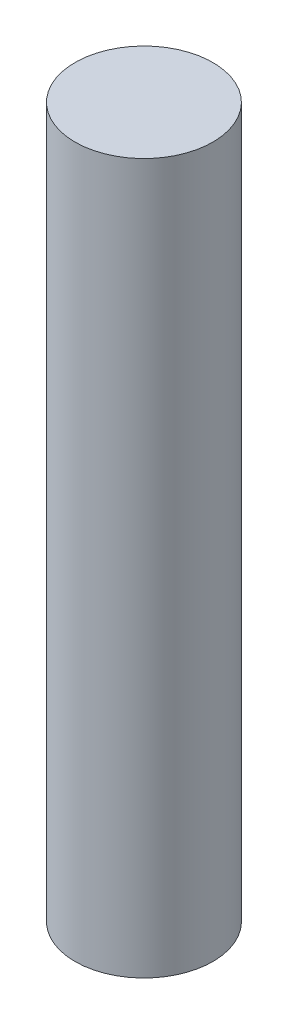
from build123d import *

# Parameters (mm, degrees)
SKETCH1_R           = 4.318
BOSS_EXTRUDE1_DEPTH = 44.45


with BuildPart() as part:
    # Sketch1 → Boss-Extrude1 (new body)
    with BuildSketch(Plane(origin=(0, 0, 0), x_dir=(1, 0, 0), z_dir=(0, 1, 0))):
        with Locations(Location((0, 0, 0), (0, 0, 270))):
            Circle(SKETCH1_R)
    extrude(amount=BOSS_EXTRUDE1_DEPTH)


solid = part.part
